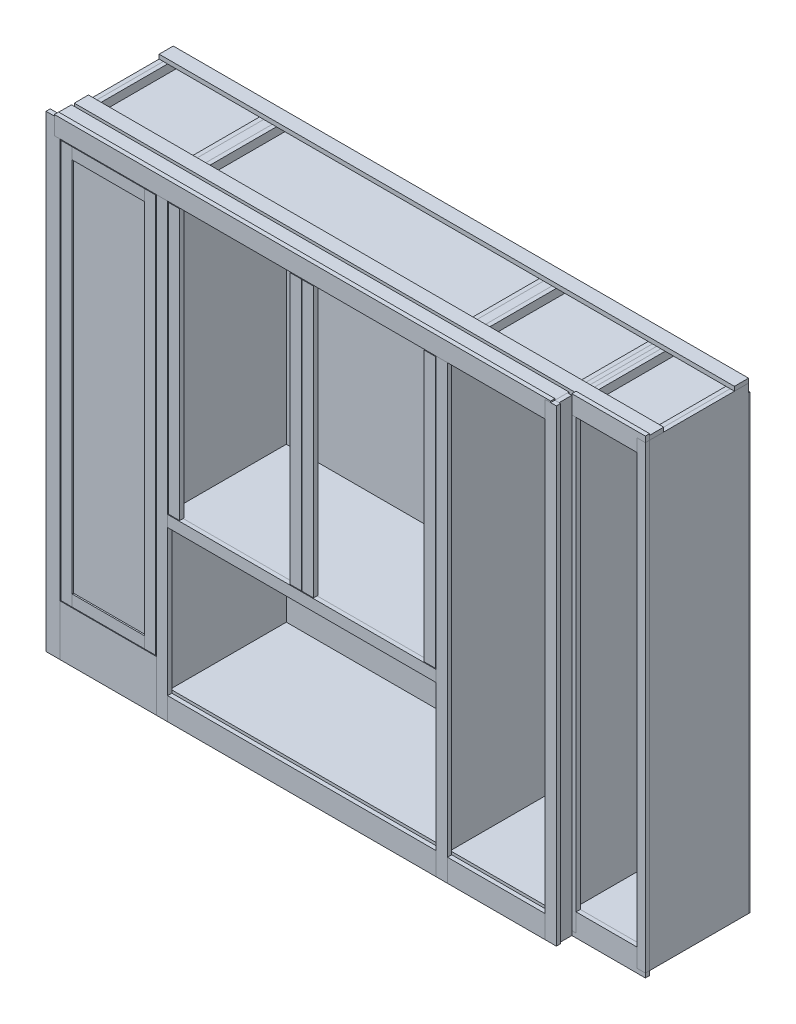
from build123d import *

# Parameters (mm, degrees)
SKETCH1_W              = 19.05
SKETCH1_H              = 2063.75
BOSS_EXTRUDE1_DEPTH    = 520.7
SKETCH1_W_2            = 38.1
BOSS_EXTRUDE1_2_DEPTH  = 520.7
SKETCH2_W              = 19.05
SKETCH2_H              = 203.2
BOSS_EXTRUDE2_DEPTH    = 520.7
BOSS_EXTRUDE2_2_DEPTH  = 520.7
SKETCH4_W              = 450.85
SKETCH4_H              = 19.05
BOSS_EXTRUDE4_DEPTH    = 520.7
SKETCH5_W              = 19.05
SKETCH5_H              = 38.1
BOSS_EXTRUDE5_DEPTH    = 520.7
BOSS_EXTRUDE5_2_DEPTH  = 520.7
SKETCH6_W              = 450.85
SKETCH6_H              = 19.05
BOSS_EXTRUDE6_DEPTH    = 520.7
SKETCH8_W              = 19.05
SKETCH8_H              = 2063.75
BOSS_EXTRUDE7_DEPTH    = 520.7
SKETCH8_W_2            = 38.1
BOSS_EXTRUDE7_2_DEPTH  = 520.7
SKETCH10_W             = 19.05
SKETCH10_H             = 76.2
BOSS_EXTRUDE8_DEPTH    = 520.7
BOSS_EXTRUDE8_2_DEPTH  = 520.7
SKETCH12_W             = 19.05
SKETCH12_H             = 38.1
BOSS_EXTRUDE9_DEPTH    = 520.7
BOSS_EXTRUDE9_2_DEPTH  = 520.7
SKETCH13_W             = 450.85
SKETCH13_H             = 19.05
BOSS_EXTRUDE10_DEPTH   = 520.7
SKETCH14_W             = 450.85
SKETCH14_H             = 19.05
BOSS_EXTRUDE11_DEPTH   = 520.7
SKETCH15_W             = 19.05
SKETCH15_H             = 76.2
BOSS_EXTRUDE12_DEPTH   = 520.7
BOSS_EXTRUDE12_2_DEPTH = 520.7
SKETCH15_H_2           = 38.1
BOSS_EXTRUDE12_3_DEPTH = 520.7
BOSS_EXTRUDE12_4_DEPTH = 520.7
SKETCH16_W             = 1219.2
SKETCH16_H             = 19.05
BOSS_EXTRUDE13_DEPTH   = 520.7
BOSS_EXTRUDE13_2_DEPTH = 520.7
SKETCH17_W             = 1219.2
SKETCH17_H             = 19.05
BOSS_EXTRUDE14_DEPTH   = 520.7
SKETCH25_W             = 19.05
SKETCH25_H             = 2063.75
BOSS_EXTRUDE22_DEPTH   = 444.5
SKETCH26_W             = 19.05
SKETCH26_H             = 2063.75
BOSS_EXTRUDE23_DEPTH   = 444.5
SKETCH27_W             = 19.05
SKETCH27_H             = 38.1
BOSS_EXTRUDE24_DEPTH   = 444.5
BOSS_EXTRUDE24_2_DEPTH = 444.5
SKETCH27_H_2           = 63.5
BOSS_EXTRUDE24_3_DEPTH = 444.5
BOSS_EXTRUDE24_4_DEPTH = 444.5
SKETCH28_W             = 311.15
SKETCH28_H             = 19.05
BOSS_EXTRUDE25_DEPTH   = 444.5
BOSS_EXTRUDE25_2_DEPTH = 444.5
SKETCH19_W             = 2235.2
SKETCH19_H             = 19.05
BOSS_EXTRUDE16_DEPTH   = 63.5
BOSS_EXTRUDE16_2_DEPTH = 63.5
SKETCH20_W             = 19.05
SKETCH20_H             = 2082.8
BOSS_EXTRUDE17_DEPTH   = 63.5
SKETCH21_W             = 63.5
SKETCH21_H             = 2101.85
BOSS_EXTRUDE18_DEPTH   = 19.05
SKETCH22_W             = 50.8
SKETCH22_H             = 2101.85
BOSS_EXTRUDE19_DEPTH   = 19.05
BOSS_EXTRUDE19_2_DEPTH = 19.05
BOSS_EXTRUDE19_3_DEPTH = 19.05
SKETCH23_W             = 508
SKETCH23_H             = 228.6
BOSS_EXTRUDE20_DEPTH   = 19.05
SKETCH24_W             = 1746.25
SKETCH24_H             = 101.6
BOSS_EXTRUDE21_DEPTH   = 19.05
SKETCH24_W_2           = 2229.573321832
SKETCH24_H_2           = 82.55
BOSS_EXTRUDE21_2_DEPTH = 19.05
SKETCH24_W_3           = 1257.3
SKETCH24_H_3           = 50.8
BOSS_EXTRUDE21_3_DEPTH = 19.05
SKETCH29_W             = 38.1
SKETCH29_H             = 2063.75
BOSS_EXTRUDE26_DEPTH   = 19.05
BOSS_EXTRUDE26_2_DEPTH = 19.05
SKETCH30_W             = 330.2
SKETCH30_H             = 82.55
BOSS_EXTRUDE27_DEPTH   = 19.05
SKETCH30_H_2           = 101.6
BOSS_EXTRUDE27_2_DEPTH = 19.05
SKETCH31_W             = 57.15
SKETCH31_H             = 2101.85
BOSS_EXTRUDE28_DEPTH   = 19.05
SKETCH33_W             = 50.8
SKETCH33_H             = 1790.7
BOSS_EXTRUDE29_DEPTH   = 19.05
BOSS_EXTRUDE29_2_DEPTH = 19.05
SKETCH34_W             = 349.25
SKETCH34_H             = 50.8
BOSS_EXTRUDE30_DEPTH   = 19.05
BOSS_EXTRUDE30_2_DEPTH = 19.05
SKETCH36_W             = 12.7
SKETCH36_H             = 6.35
CUT_EXTRUDE1_DEPTH     = 3130.301969789
SKETCH37_W             = 12.7
SKETCH37_H             = 6.35
CUT_EXTRUDE2_DEPTH     = 3130.301969789
SKETCH39_W             = 6.35
SKETCH39_H             = 12.7
CUT_EXTRUDE3_DEPTH     = 3321.07398421
SKETCH40_W             = 349.25
SKETCH40_H             = 1714.5
BOSS_EXTRUDE31_DEPTH   = 6.35
SKETCH41_W             = 2584.45
SKETCH41_H             = 2025.65
BOSS_EXTRUDE32_DEPTH   = 6.35
SKETCH42_W             = 2584.45
SKETCH42_H             = 63.5
BOSS_EXTRUDE33_DEPTH   = 19.05
BOSS_EXTRUDE33_2_DEPTH = 19.05
SKETCH43_W             = 50.8
SKETCH43_H             = 1212.85
BOSS_EXTRUDE34_DEPTH   = 19.05
BOSS_EXTRUDE34_2_DEPTH = 19.05
SKETCH44_W             = 50.8
SKETCH44_H             = 1212.85
BOSS_EXTRUDE35_DEPTH   = 19.05
BOSS_EXTRUDE35_2_DEPTH = 19.05


with BuildPart() as part:
    # Sketch1 → Boss-Extrude1 (new body)
    with BuildSketch(Plane.XY):
        with Locations((-244.475, 1050.925)):
            Rectangle(SKETCH1_W, SKETCH1_H)
    extrude(amount=-BOSS_EXTRUDE1_DEPTH)


with BuildPart() as body_2:
    # Sketch1 → Boss-Extrude1 2 (new body)
    with BuildSketch(Plane.XY):
        with Locations((234.95, 1050.925)):
            Rectangle(SKETCH1_W_2, SKETCH1_H)
    extrude(amount=-BOSS_EXTRUDE1_2_DEPTH)


with BuildPart() as body_3:
    # Sketch2 → Boss-Extrude2 (new body)
    with BuildSketch(Plane(origin=(0, 0, -520.7), x_dir=(-1, 0, 0), z_dir=(0, 0, -1))):
        with Locations((-206.375, 120.65)):
            Rectangle(SKETCH2_W, SKETCH2_H)
    extrude(amount=-BOSS_EXTRUDE2_DEPTH)


with BuildPart() as body_4:
    # Sketch2 → Boss-Extrude2 2 (new body)
    with BuildSketch(Plane(origin=(0, 0, -520.7), x_dir=(-1, 0, 0), z_dir=(0, 0, -1))):
        with Locations((225.425, 120.65)):
            Rectangle(SKETCH2_W, SKETCH2_H)
    extrude(amount=-BOSS_EXTRUDE2_2_DEPTH)


with BuildPart() as body_5:
    # Sketch4 → Boss-Extrude4 (new body)
    with BuildSketch(Plane.XY.offset(-520.7)):
        with Locations((-9.525, 231.775)):
            Rectangle(SKETCH4_W, SKETCH4_H)
    extrude(amount=BOSS_EXTRUDE4_DEPTH)


with BuildPart() as body_6:
    # Sketch5 → Boss-Extrude5 (new body)
    with BuildSketch(Plane.XY.offset(-520.7)):
        with Locations((206.375, 2063.75)):
            Rectangle(SKETCH5_W, SKETCH5_H)
    extrude(amount=BOSS_EXTRUDE5_DEPTH)


with BuildPart() as body_7:
    # Sketch5 → Boss-Extrude5 2 (new body)
    with BuildSketch(Plane.XY.offset(-520.7)):
        with Locations((-225.425, 2063.75)):
            Rectangle(SKETCH5_W, SKETCH5_H)
    extrude(amount=BOSS_EXTRUDE5_2_DEPTH)


with BuildPart() as body_8:
    # Sketch6 → Boss-Extrude6 (new body)
    with BuildSketch(Plane.XY.offset(-520.7)):
        with Locations((-9.525, 2035.175)):
            Rectangle(SKETCH6_W, SKETCH6_H)
    extrude(amount=BOSS_EXTRUDE6_DEPTH)


with BuildPart() as body_9:
    # Sketch8 → Boss-Extrude7 (new body)
    with BuildSketch(Plane.XY):
        with Locations((1971.675, 1050.925)):
            Rectangle(SKETCH8_W, SKETCH8_H)
    extrude(amount=-BOSS_EXTRUDE7_DEPTH)


with BuildPart() as body_10:
    # Sketch8 → Boss-Extrude7 2 (new body)
    with BuildSketch(Plane.XY):
        with Locations((1492.25, 1050.925)):
            Rectangle(SKETCH8_W_2, SKETCH8_H)
    extrude(amount=-BOSS_EXTRUDE7_2_DEPTH)


with BuildPart() as body_11:
    # Sketch10 → Boss-Extrude8 (new body)
    with BuildSketch(Plane(origin=(0, 0, -520.7), x_dir=(-1, 0, 0), z_dir=(0, 0, -1))):
        with Locations((-1520.825, 57.15)):
            Rectangle(SKETCH10_W, SKETCH10_H)
    extrude(amount=-BOSS_EXTRUDE8_DEPTH)


with BuildPart() as body_12:
    # Sketch10 → Boss-Extrude8 2 (new body)
    with BuildSketch(Plane(origin=(0, 0, -520.7), x_dir=(-1, 0, 0), z_dir=(0, 0, -1))):
        with Locations((-1952.625, 57.15)):
            Rectangle(SKETCH10_W, SKETCH10_H)
    extrude(amount=-BOSS_EXTRUDE8_2_DEPTH)


with BuildPart() as body_13:
    # Sketch12 → Boss-Extrude9 (new body)
    with BuildSketch(Plane(origin=(0, 0, -520.7), x_dir=(-1, 0, 0), z_dir=(0, 0, -1))):
        with Locations((-1520.825, 2063.75)):
            Rectangle(SKETCH12_W, SKETCH12_H)
    extrude(amount=-BOSS_EXTRUDE9_DEPTH)


with BuildPart() as body_14:
    # Sketch12 → Boss-Extrude9 2 (new body)
    with BuildSketch(Plane(origin=(0, 0, -520.7), x_dir=(-1, 0, 0), z_dir=(0, 0, -1))):
        with Locations((-1952.625, 2063.75)):
            Rectangle(SKETCH12_W, SKETCH12_H)
    extrude(amount=-BOSS_EXTRUDE9_2_DEPTH)


with BuildPart() as body_15:
    # Sketch13 → Boss-Extrude10 (new body)
    with BuildSketch(Plane(origin=(0, 0, -520.7), x_dir=(-1, 0, 0), z_dir=(0, 0, -1))):
        with Locations((-1736.725, 104.775)):
            Rectangle(SKETCH13_W, SKETCH13_H)
    extrude(amount=-BOSS_EXTRUDE10_DEPTH)


with BuildPart() as body_16:
    # Sketch14 → Boss-Extrude11 (new body)
    with BuildSketch(Plane(origin=(0, 0, -520.7), x_dir=(-1, 0, 0), z_dir=(0, 0, -1))):
        with Locations((-1736.725, 2035.175)):
            Rectangle(SKETCH14_W, SKETCH14_H)
    extrude(amount=-BOSS_EXTRUDE11_DEPTH)


with BuildPart() as body_17:
    # Sketch15 → Boss-Extrude12 (new body)
    with BuildSketch(Plane(origin=(0, 0, -520.7), x_dir=(-1, 0, 0), z_dir=(0, 0, -1))):
        with Locations((-263.525, 57.15)):
            Rectangle(SKETCH15_W, SKETCH15_H)
    extrude(amount=-BOSS_EXTRUDE12_DEPTH)


with BuildPart() as body_18:
    # Sketch15 → Boss-Extrude12 2 (new body)
    with BuildSketch(Plane(origin=(0, 0, -520.7), x_dir=(-1, 0, 0), z_dir=(0, 0, -1))):
        with Locations((-1463.675, 57.15)):
            Rectangle(SKETCH15_W, SKETCH15_H)
    extrude(amount=-BOSS_EXTRUDE12_2_DEPTH)


with BuildPart() as body_19:
    # Sketch15 → Boss-Extrude12 3 (new body)
    with BuildSketch(Plane(origin=(0, 0, -520.7), x_dir=(-1, 0, 0), z_dir=(0, 0, -1))):
        with Locations((-1463.675, 2063.75)):
            Rectangle(SKETCH15_W, SKETCH15_H_2)
    extrude(amount=-BOSS_EXTRUDE12_3_DEPTH)


with BuildPart() as body_20:
    # Sketch15 → Boss-Extrude12 4 (new body)
    with BuildSketch(Plane(origin=(0, 0, -520.7), x_dir=(-1, 0, 0), z_dir=(0, 0, -1))):
        with Locations((-263.525, 2063.75)):
            Rectangle(SKETCH15_W, SKETCH15_H_2)
    extrude(amount=-BOSS_EXTRUDE12_4_DEPTH)


with BuildPart() as body_21:
    # Sketch16 → Boss-Extrude13 (new body)
    with BuildSketch(Plane(origin=(0, 0, -520.7), x_dir=(-1, 0, 0), z_dir=(0, 0, -1))):
        with Locations((-863.6, 2035.175)):
            Rectangle(SKETCH16_W, SKETCH16_H)
    extrude(amount=-BOSS_EXTRUDE13_DEPTH)


with BuildPart() as body_22:
    # Sketch16 → Boss-Extrude13 2 (new body)
    with BuildSketch(Plane(origin=(0, 0, -520.7), x_dir=(-1, 0, 0), z_dir=(0, 0, -1))):
        with Locations((-863.6, 104.775)):
            Rectangle(SKETCH16_W, SKETCH16_H)
    extrude(amount=-BOSS_EXTRUDE13_2_DEPTH)


with BuildPart() as body_23:
    # Sketch17 → Boss-Extrude14 (new body)
    with BuildSketch(Plane(origin=(0, 0, -520.7), x_dir=(-1, 0, 0), z_dir=(0, 0, -1))):
        with Locations((-863.6, 796.925)):
            Rectangle(SKETCH17_W, SKETCH17_H)
    extrude(amount=-BOSS_EXTRUDE14_DEPTH)


with BuildPart() as body_24:
    # Sketch25 → Boss-Extrude22 (new body)
    with BuildSketch(Plane(origin=(0, 0, -520.7), x_dir=(-1, 0, 0), z_dir=(0, 0, -1))):
        with Locations((-1990.725, 1050.925)):
            Rectangle(SKETCH25_W, SKETCH25_H)
    extrude(amount=-BOSS_EXTRUDE22_DEPTH)


with BuildPart() as body_25:
    # Sketch26 → Boss-Extrude23 (new body)
    with BuildSketch(Plane.XY.offset(-520.7)):
        with Locations((2320.925, 1050.925)):
            Rectangle(SKETCH26_W, SKETCH26_H)
    extrude(amount=BOSS_EXTRUDE23_DEPTH)


with BuildPart() as body_26:
    # Sketch27 → Boss-Extrude24 (new body)
    with BuildSketch(Plane(origin=(0, 0, -520.7), x_dir=(-1, 0, 0), z_dir=(0, 0, -1))):
        with Locations((-2009.775, 2063.75)):
            Rectangle(SKETCH27_W, SKETCH27_H)
    extrude(amount=-BOSS_EXTRUDE24_DEPTH)


with BuildPart() as body_27:
    # Sketch27 → Boss-Extrude24 2 (new body)
    with BuildSketch(Plane(origin=(0, 0, -520.7), x_dir=(-1, 0, 0), z_dir=(0, 0, -1))):
        with Locations((-2301.875, 2063.75)):
            Rectangle(SKETCH27_W, SKETCH27_H)
    extrude(amount=-BOSS_EXTRUDE24_2_DEPTH)


with BuildPart() as body_28:
    # Sketch27 → Boss-Extrude24 3 (new body)
    with BuildSketch(Plane(origin=(0, 0, -520.7), x_dir=(-1, 0, 0), z_dir=(0, 0, -1))):
        with Locations((-2009.775, 50.8)):
            Rectangle(SKETCH27_W, SKETCH27_H_2)
    extrude(amount=-BOSS_EXTRUDE24_3_DEPTH)


with BuildPart() as body_29:
    # Sketch27 → Boss-Extrude24 4 (new body)
    with BuildSketch(Plane(origin=(0, 0, -520.7), x_dir=(-1, 0, 0), z_dir=(0, 0, -1))):
        with Locations((-2301.875, 50.8)):
            Rectangle(SKETCH27_W, SKETCH27_H_2)
    extrude(amount=-BOSS_EXTRUDE24_4_DEPTH)


with BuildPart() as body_30:
    # Sketch28 → Boss-Extrude25 (new body)
    with BuildSketch(Plane(origin=(0, 0, -520.7), x_dir=(-1, 0, 0), z_dir=(0, 0, -1))):
        with Locations((-2155.825, 92.075)):
            Rectangle(SKETCH28_W, SKETCH28_H)
    extrude(amount=-BOSS_EXTRUDE25_DEPTH)


with BuildPart() as body_31:
    # Sketch28 → Boss-Extrude25 2 (new body)
    with BuildSketch(Plane(origin=(0, 0, -520.7), x_dir=(-1, 0, 0), z_dir=(0, 0, -1))):
        with Locations((-2155.825, 2035.175)):
            Rectangle(SKETCH28_W, SKETCH28_H)
    extrude(amount=-BOSS_EXTRUDE25_2_DEPTH)


with BuildPart() as body_32:
    # Sketch19 → Boss-Extrude16 (new body)
    with BuildSketch(Plane.XY):
        with Locations((863.6, 9.525)):
            Rectangle(SKETCH19_W, SKETCH19_H)
    extrude(amount=-BOSS_EXTRUDE16_DEPTH)


with BuildPart() as body_33:
    # Sketch19 → Boss-Extrude16 2 (new body)
    with BuildSketch(Plane.XY):
        with Locations((863.6, 2092.325)):
            Rectangle(SKETCH19_W, SKETCH19_H)
    extrude(amount=-BOSS_EXTRUDE16_2_DEPTH)


with BuildPart() as body_34:
    # Sketch20 → Boss-Extrude17 (new body)
    with BuildSketch(Plane.XY):
        with Locations((-263.525, 1041.4)):
            Rectangle(SKETCH20_W, SKETCH20_H)
    extrude(amount=-BOSS_EXTRUDE17_DEPTH)


with BuildPart() as body_35:
    # Sketch21 → Boss-Extrude18 (new body)
    with BuildSketch(Plane.XY):
        with Locations((-254, 1050.925)):
            Rectangle(SKETCH21_W, SKETCH21_H)
    extrude(amount=BOSS_EXTRUDE18_DEPTH)


with BuildPart() as body_36:
    # Sketch22 → Boss-Extrude19 (new body)
    with BuildSketch(Plane.XY):
        with Locations((234.95, 1050.925)):
            Rectangle(SKETCH22_W, SKETCH22_H)
    extrude(amount=BOSS_EXTRUDE19_DEPTH)


with BuildPart() as body_37:
    # Sketch22 → Boss-Extrude19 2 (new body)
    with BuildSketch(Plane.XY):
        with Locations((1492.25, 1050.925)):
            Rectangle(SKETCH22_W, SKETCH22_H)
    extrude(amount=BOSS_EXTRUDE19_2_DEPTH)


with BuildPart() as body_38:
    # Sketch22 → Boss-Extrude19 3 (new body)
    with BuildSketch(Plane.XY):
        with Locations((1981.2, 1050.925)):
            Rectangle(SKETCH22_W, SKETCH22_H)
    extrude(amount=BOSS_EXTRUDE19_3_DEPTH)


with BuildPart() as body_39:
    # Sketch23 → Boss-Extrude20 (new body)
    with BuildSketch(Plane.XY):
        with Locations((-19.05, 114.3)):
            Rectangle(SKETCH23_W, SKETCH23_H)
    extrude(amount=BOSS_EXTRUDE20_DEPTH)


with BuildPart() as body_40:
    # Sketch24 → Boss-Extrude21 (new body)
    with BuildSketch(Plane.XY):
        with Locations((1108.075, 50.8)):
            Rectangle(SKETCH24_W, SKETCH24_H)
    extrude(amount=BOSS_EXTRUDE21_DEPTH)


with BuildPart() as body_41:
    # Sketch24 → Boss-Extrude21 2 (new body)
    with BuildSketch(Plane.XY):
        with Locations((866.413339084, 2066.925)):
            Rectangle(SKETCH24_W_2, SKETCH24_H_2)
    extrude(amount=BOSS_EXTRUDE21_2_DEPTH)


with BuildPart() as body_42:
    # Sketch24 → Boss-Extrude21 3 (new body)
    with BuildSketch(Plane.XY):
        with Locations((863.6, 781.05)):
            Rectangle(SKETCH24_W_3, SKETCH24_H_3)
    extrude(amount=BOSS_EXTRUDE21_3_DEPTH)


with BuildPart() as body_43:
    # Sketch29 → Boss-Extrude26 (new body)
    with BuildSketch(Plane.XY.offset(-76.2)):
        with Locations((2311.4, 1050.925)):
            Rectangle(SKETCH29_W, SKETCH29_H)
    extrude(amount=BOSS_EXTRUDE26_DEPTH)


with BuildPart() as body_44:
    # Sketch29 → Boss-Extrude26 2 (new body)
    with BuildSketch(Plane.XY.offset(-76.2)):
        with Locations((2000.25, 1050.925)):
            Rectangle(SKETCH29_W, SKETCH29_H)
    extrude(amount=BOSS_EXTRUDE26_2_DEPTH)


with BuildPart() as body_45:
    # Sketch30 → Boss-Extrude27 (new body)
    with BuildSketch(Plane.XY.offset(-76.2)):
        with Locations((2165.35, 2066.925)):
            Rectangle(SKETCH30_W, SKETCH30_H)
    extrude(amount=BOSS_EXTRUDE27_DEPTH)


with BuildPart() as body_46:
    # Sketch30 → Boss-Extrude27 2 (new body)
    with BuildSketch(Plane.XY.offset(-76.2)):
        with Locations((2165.35, 50.8)):
            Rectangle(SKETCH30_W, SKETCH30_H_2)
    extrude(amount=BOSS_EXTRUDE27_2_DEPTH)


with BuildPart() as body_47:
    # Sketch31 → Boss-Extrude28 (new body)
    with BuildSketch(Plane(origin=(1981.2, 0, 0), x_dir=(0, 0, -1), z_dir=(1, 0, 0))):
        with Locations((28.575, 1050.925)):
            Rectangle(SKETCH31_W, SKETCH31_H)
    extrude(amount=BOSS_EXTRUDE28_DEPTH)


with BuildPart() as body_48:
    # Sketch33 → Boss-Extrude29 (new body)
    with BuildSketch(Plane.XY):
        with Locations((-193.675, 1127.125)):
            Rectangle(SKETCH33_W, SKETCH33_H)
    extrude(amount=BOSS_EXTRUDE29_DEPTH)


with BuildPart() as body_49:
    # Sketch33 → Boss-Extrude29 2 (new body)
    with BuildSketch(Plane.XY):
        with Locations((180.975, 1127.125)):
            Rectangle(SKETCH33_W, SKETCH33_H)
    extrude(amount=BOSS_EXTRUDE29_2_DEPTH)


with BuildPart() as body_50:
    # Sketch34 → Boss-Extrude30 (new body)
    with BuildSketch(Plane.XY):
        with Locations((-6.35, 1997.075)):
            Rectangle(SKETCH34_W, SKETCH34_H)
    extrude(amount=BOSS_EXTRUDE30_DEPTH)


with BuildPart() as body_51:
    # Sketch34 → Boss-Extrude30 2 (new body)
    with BuildSketch(Plane.XY):
        with Locations((-6.35, 257.175)):
            Rectangle(SKETCH34_W, SKETCH34_H)
    extrude(amount=BOSS_EXTRUDE30_2_DEPTH)


with BuildPart() as cut_extrude1_tool:
    # Sketch36 → Cut-Extrude1 (new, through all)
    with BuildSketch(Plane(origin=(0, 2022.475, 0), x_dir=(1, 0, 0), z_dir=(0, 1, 0))):
        with Locations((-174.625, -9.525)):
            Rectangle(SKETCH36_W, SKETCH36_H)
        with Locations((161.925, -9.525)):
            Rectangle(SKETCH36_W, SKETCH36_H)
    extrude(amount=-CUT_EXTRUDE1_DEPTH)


with BuildPart() as body_48_1:
    add(body_48.part)

    # Cut-Extrude1: cut by cut_extrude1_tool
    add(cut_extrude1_tool.part, mode=Mode.SUBTRACT)


with BuildPart() as body_49_1:
    add(body_49.part)

    # Cut-Extrude1: cut by cut_extrude1_tool
    add(cut_extrude1_tool.part, mode=Mode.SUBTRACT)


with BuildPart() as cut_extrude2_tool:
    # Sketch37 → Cut-Extrude2 (new, through all)
    with BuildSketch(Plane(origin=(0, 2022.475, 0), x_dir=(1, 0, 0), z_dir=(0, 1, 0))):
        with Locations((-174.625, -3.175)):
            Rectangle(SKETCH37_W, SKETCH37_H)
        with Locations((-174.625, -15.875)):
            Rectangle(SKETCH37_W, SKETCH37_H)
        with Locations((161.925, -15.875)):
            Rectangle(SKETCH37_W, SKETCH37_H)
        with Locations((161.925, -3.175)):
            Rectangle(SKETCH37_W, SKETCH37_H)
    extrude(amount=-CUT_EXTRUDE2_DEPTH)


with BuildPart() as body_50_1:
    add(body_50.part)

    # Cut-Extrude2: cut by cut_extrude2_tool
    add(cut_extrude2_tool.part, mode=Mode.SUBTRACT)


with BuildPart() as body_51_1:
    add(body_51.part)

    # Cut-Extrude2: cut by cut_extrude2_tool
    add(cut_extrude2_tool.part, mode=Mode.SUBTRACT)


with BuildPart() as cut_extrude3_tool:
    # Sketch39 → Cut-Extrude3 (new, through all)
    with BuildSketch(Plane.ZY.offset(180.975)):
        with Locations((9.525, 1978.025)):
            Rectangle(SKETCH39_W, SKETCH39_H)
        with Locations((9.525, 276.225)):
            Rectangle(SKETCH39_W, SKETCH39_H)
    extrude(amount=-CUT_EXTRUDE3_DEPTH)


with BuildPart() as body_51_2:
    add(body_51_1.part)

    # Cut-Extrude3: cut by cut_extrude3_tool
    add(cut_extrude3_tool.part, mode=Mode.SUBTRACT)


with BuildPart() as body_50_2:
    add(body_50_1.part)

    # Cut-Extrude3: cut by cut_extrude3_tool
    add(cut_extrude3_tool.part, mode=Mode.SUBTRACT)


with BuildPart() as body_52:
    # Sketch40 → Boss-Extrude31 (new body)
    with BuildSketch(Plane(origin=(0, 0, 6.35), x_dir=(-1, 0, 0), z_dir=(0, 0, -1))):
        with Locations((6.35, 1127.125)):
            Rectangle(SKETCH40_W, SKETCH40_H)
    extrude(amount=-BOSS_EXTRUDE31_DEPTH)


with BuildPart() as body_53:
    # Sketch41 → Boss-Extrude32 (new body)
    with BuildSketch(Plane(origin=(0, 0, -520.7), x_dir=(-1, 0, 0), z_dir=(0, 0, -1))):
        with Locations((-1038.225, 1031.875)):
            Rectangle(SKETCH41_W, SKETCH41_H)
    extrude(amount=BOSS_EXTRUDE32_DEPTH)


with BuildPart() as body_54:
    # Sketch42 → Boss-Extrude33 (new body)
    with BuildSketch(Plane(origin=(0, 2082.8, 0), x_dir=(1, 0, 0), z_dir=(0, 1, 0))):
        with Locations((1038.225, 488.95)):
            Rectangle(SKETCH42_W, SKETCH42_H)
    extrude(amount=BOSS_EXTRUDE33_DEPTH)


with BuildPart() as body_55:
    # Sketch42 → Boss-Extrude33 2 (new body)
    with BuildSketch(Plane(origin=(0, 2082.8, 0), x_dir=(1, 0, 0), z_dir=(0, 1, 0))):
        with Locations((1038.225, 107.95)):
            Rectangle(SKETCH42_W, SKETCH42_H)
    extrude(amount=BOSS_EXTRUDE33_2_DEPTH)


with BuildPart() as body_56:
    # Sketch43 → Boss-Extrude34 (new body)
    with BuildSketch(Plane.XY):
        with Locations((1438.275, 1416.05)):
            Rectangle(SKETCH43_W, SKETCH43_H)
    extrude(amount=BOSS_EXTRUDE34_DEPTH)


with BuildPart() as body_57:
    # Sketch43 → Boss-Extrude34 2 (new body)
    with BuildSketch(Plane.XY):
        with Locations((288.925, 1416.05)):
            Rectangle(SKETCH43_W, SKETCH43_H)
    extrude(amount=BOSS_EXTRUDE34_2_DEPTH)


with BuildPart() as body_58:
    # Sketch44 → Boss-Extrude35 (new body)
    with BuildSketch(Plane.XY):
        with Locations((836.6125, 1416.05)):
            Rectangle(SKETCH44_W, SKETCH44_H)
    extrude(amount=BOSS_EXTRUDE35_DEPTH)


with BuildPart() as body_59:
    # Sketch44 → Boss-Extrude35 2 (new body)
    with BuildSketch(Plane.XY):
        with Locations((890.5875, 1416.05)):
            Rectangle(SKETCH44_W, SKETCH44_H)
    extrude(amount=BOSS_EXTRUDE35_2_DEPTH)


solid = Compound([part.part, body_2.part, body_3.part, body_4.part, body_5.part, body_6.part, body_7.part, body_8.part, body_9.part, body_10.part, body_11.part, body_12.part, body_13.part, body_14.part, body_15.part, body_16.part, body_17.part, body_18.part, body_19.part, body_20.part, body_21.part, body_22.part, body_23.part, body_24.part, body_25.part, body_26.part, body_27.part, body_28.part, body_29.part, body_30.part, body_31.part, body_32.part, body_33.part, body_34.part, body_35.part, body_36.part, body_37.part, body_38.part, body_39.part, body_40.part, body_41.part, body_42.part, body_43.part, body_44.part, body_45.part, body_46.part, body_47.part, body_48_1.part, body_49_1.part, body_51_2.part, body_50_2.part, body_52.part, body_53.part, body_54.part, body_55.part, body_56.part, body_57.part, body_58.part, body_59.part])
